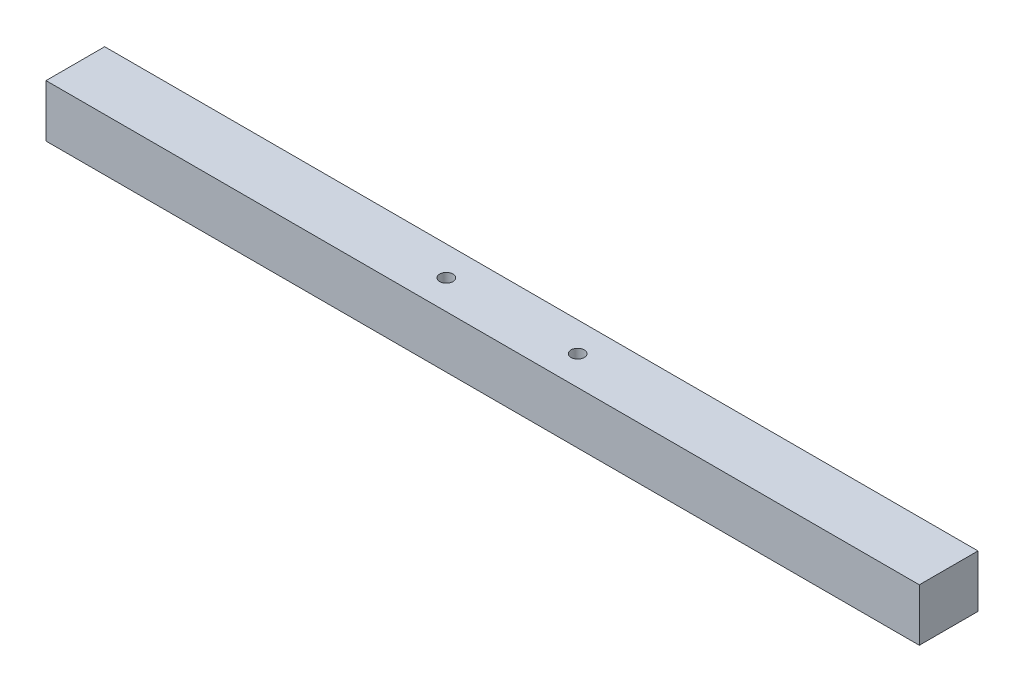
from build123d import *

# Parameters (mm, degrees)
CROQUIS1_W              = 250
CROQUIS1_H              = 16.8
CROQUIS1_R              = 1.9
SALIENTE_EXTRUIR1_DEPTH = 15


with BuildPart() as part:
    # Croquis1 → Saliente-Extruir1 (new body)
    with BuildSketch(Plane(origin=(0, 0, 0), x_dir=(1, 0, 0), z_dir=(0, 1, 0))):
        Rectangle(CROQUIS1_W, CROQUIS1_H)
        with Locations(Location((-18.8, 0, 0), (0, 0, 270))):
            Circle(CROQUIS1_R, mode=Mode.SUBTRACT)
        with Locations(Location((18.8, 0, 0), (0, 0, 270))):
            Circle(CROQUIS1_R, mode=Mode.SUBTRACT)
    extrude(amount=SALIENTE_EXTRUIR1_DEPTH)


solid = part.part
